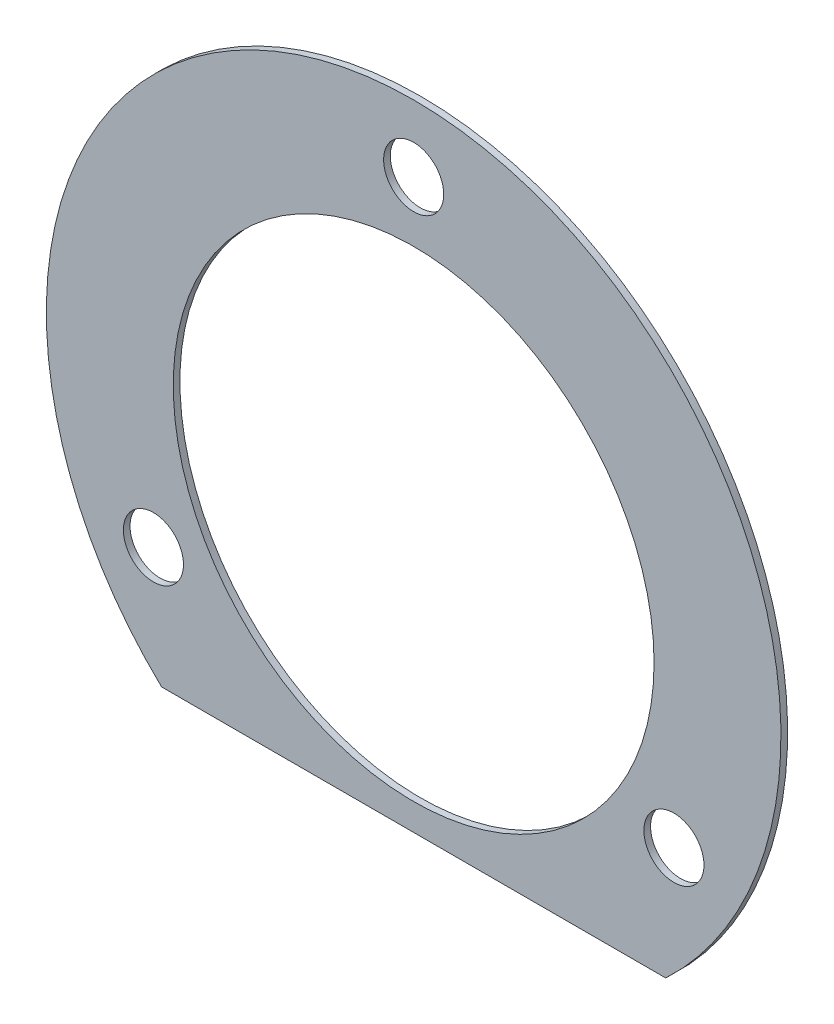
from build123d import *

# Parameters (mm, degrees)
SCHIZZO1_R                   = 55
SCHIZZO1_R_2                 = 36
ESTRUSIONE_ESTRUSIONE1_DEPTH = 1
SCHIZZO2_R                   = 4.5
TAGLIO_ESTRUSIONE1_DEPTH     = 78.788173908
SCHIZZO4_OUTSIDE_W           = 143.114
SCHIZZO4_OUTSIDE_H           = 143.114
TAGLIO_ESTRUSIONE2_DEPTH     = 78.788173908


with BuildPart() as part:
    # Schizzo1 → Estrusione-Estrusione1 (new body)
    with BuildSketch(Plane.XY):
        Circle(SCHIZZO1_R)
        Circle(SCHIZZO1_R_2, mode=Mode.SUBTRACT)
    extrude(amount=ESTRUSIONE_ESTRUSIONE1_DEPTH)

    # Schizzo2 → Taglio-Estrusione1 (cut, through all)
    with BuildSketch(Plane.XY.offset(1)):
        with Locations((0, 45)):
            Circle(SCHIZZO2_R)
        with Locations((38.97114317, -22.5)):
            Circle(SCHIZZO2_R)
        with Locations((-38.97114317, -22.5)):
            Circle(SCHIZZO2_R)
    extrude(amount=-TAGLIO_ESTRUSIONE1_DEPTH, mode=Mode.SUBTRACT)

    # Schizzo4 outside → Taglio-Estrusione2 (cut, through all)
    with BuildSketch(Plane.XY):
        Rectangle(SCHIZZO4_OUTSIDE_W, SCHIZZO4_OUTSIDE_H)
        with BuildLine():
            Line((37.749172176, -40), (-37.749172176, -40))
            ThreePointArc((-37.749172176, -40), (0, 55), (37.749172176, -40))
        make_face(mode=Mode.SUBTRACT)
    extrude(amount=TAGLIO_ESTRUSIONE2_DEPTH, mode=Mode.SUBTRACT)


solid = part.part
